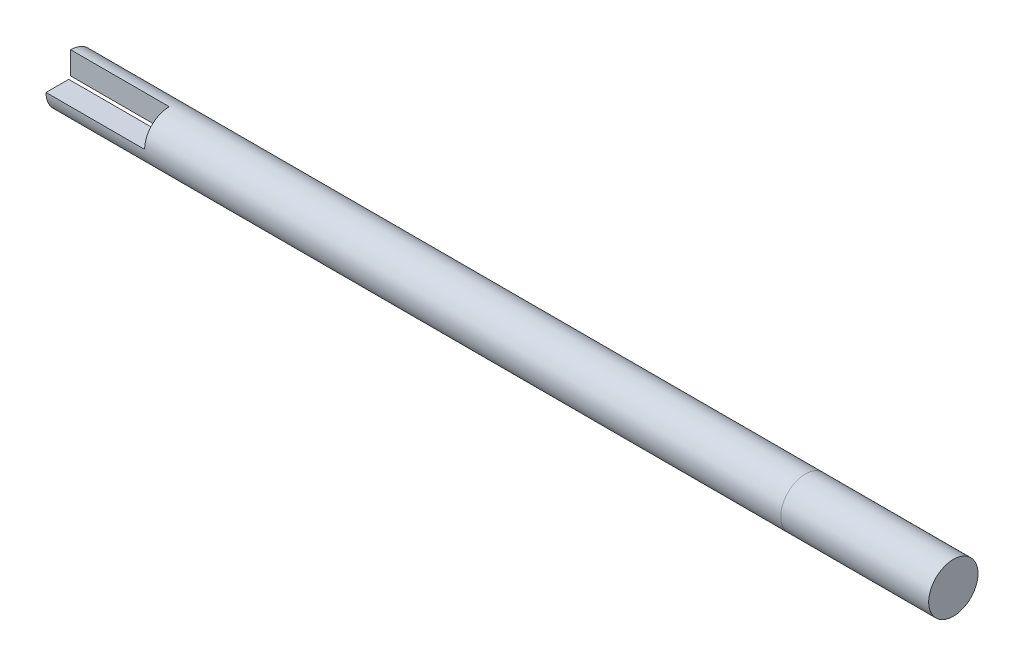
from build123d import *

# Parameters (mm, degrees)
SWEEP1_PROFILE_R   = 2.5
CUT_EXTRUDE1_DEPTH = 10


with BuildPart() as part:
    # Sweep1: sweep along a path in Sketch1
    with BuildLine(Plane(origin=(0, 0, 0), x_dir=(1, 0, 0), z_dir=(0, 1, 0))) as sweep1_path:
        Line((339.702814789, 0), (324.702814789, 0))
        Line((324.702814789, 0), (250.204561609, 0))
    # Sweep1 profile (on start of the path) → Sweep1 (sweep)
    with BuildSketch(Plane(origin=(339.702814789, 0, 0), x_dir=(0, 0, -1), z_dir=(-1, 0, 0))):
        Circle(SWEEP1_PROFILE_R)
    sweep(path=sweep1_path.line)

    # Sketch4 → Cut-Extrude1 (cut)
    with BuildSketch(Plane(origin=(250.204561609, 0, 0), x_dir=(0, 0, -1), z_dir=(-1, 0, 0))):
        with BuildLine():
            Line((-2.5, 0), (-0.194982329, 0))
            ThreePointArc((-0.194982329, 0), (-0.137873327, 0.137873327), (0, 0.194982329))
            Line((0, 0.194982329), (0, 2.5))
            ThreePointArc((0, 2.5), (1.767766953, 1.767766953), (2.5, 0))
            Line((2.5, 0), (0.194982329, 0))
            ThreePointArc((0.194982329, 0), (0.137873327, -0.137873327), (0, -0.194982329))
            Line((0, -0.194982329), (0, -2.5))
            ThreePointArc((0, -2.5), (-1.767766953, -1.767766953), (-2.5, 0))
        make_face()
    extrude(amount=-CUT_EXTRUDE1_DEPTH, mode=Mode.SUBTRACT)


solid = part.part
